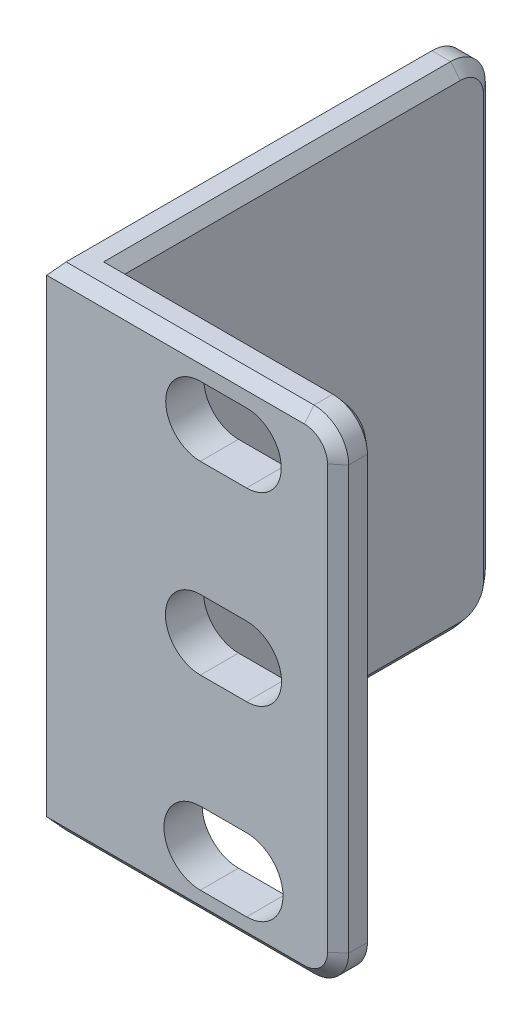
from build123d import *
from OCP.BRepFilletAPI import BRepFilletAPI_MakeChamfer

# Parameters (mm, degrees)
EXTRUDE_1_DEPTH     = 21.3
CUT_EXTRUDE_1_DEPTH = 42.6
FILLET_1_R          = 3
CHAMFER_1_SIZE      = 1
CHAMFER_1_SIZE2     = 0.839099631


with BuildPart() as part:
    # Эскиз1 → Бобышка-Вытянуть1 (new, symmetric)
    with BuildSketch(Plane(origin=(0, 0, 0), x_dir=(1, 0, 0), z_dir=(0, 1, 0))):
        Polygon((0, 0), (25.3, 0), (25.3, 3.3), (3.3, 3.3), (3.3, 35.5), (0, 35.5), align=None)
    extrude(amount=EXTRUDE_1_DEPTH, both=True)

    # Эскиз2 → Вырез-Вытянуть1 (cut)
    with BuildSketch(Plane.XY):
        with BuildLine():
            Line((17.3, 13), (13.3, 13))
            ThreePointArc((13.3, 13), (10.3, 16), (13.3, 19))
            Line((13.3, 19), (17.3, 19))
            ThreePointArc((17.3, 19), (20.3, 16), (17.3, 13))
        make_face()
        with BuildLine():
            Line((17.3, -3.022560491), (13.3, -3.022560491))
            ThreePointArc((13.3, -3.022560491), (10.277439509, 0), (13.3, 3.022560491))
            Line((13.3, 3.022560491), (17.3, 3.022560491))
            ThreePointArc((17.3, 3.022560491), (20.322560491, 0), (17.3, -3.022560491))
        make_face()
        with BuildLine():
            Line((17.3, -19.150761356), (13.3, -19.150761356))
            ThreePointArc((13.3, -19.150761356), (10.149238644, -16), (13.3, -12.849238644))
            Line((13.3, -12.849238644), (17.3, -12.849238644))
            ThreePointArc((17.3, -12.849238644), (20.450761356, -16), (17.3, -19.150761356))
        make_face()
    extrude(amount=-CUT_EXTRUDE_1_DEPTH, mode=Mode.SUBTRACT)

    # Скругление1
    fillet_1_edges = [part.edges().sort_by_distance(p)[0] for p in [
        (25.3, 21.3, -1.65),
        (1.65, 21.3, -35.5),
        (1.65, -21.3, -35.5),
        (25.3, -21.3, -1.65),
    ]]
    fillet(fillet_1_edges, radius=FILLET_1_R)

    # Фаска1: one chamfer whose edges measure the first distance from different faces: ONE call of the kernel's chamfer builder (chamfer() names one face for all edges)
    chamfer_1_edges_1 = [part.edges().sort_by_distance(p)[0] for p in [
        (24.421320344, -20.421320344, 0),
        (11.15, -21.3, 0),
        (11.15, 21.3, 0),
        (25.3, 0, 0),
        (24.421320344, 20.421320344, 0),
    ]]
    chamfer_1_side_1 = [part.faces().sort_by_distance(p)[0] for p in [
        (11.15, -20.804535571, 0),
    ]]
    chamfer_1_edges_2 = [part.edges().sort_by_distance(p)[0] for p in [
        (3.3, 21.3, -17.9),
        (3.3, -21.3, -17.9),
        (3.3, 0, -35.5),
        (3.3, 20.421320344, -34.621320344),
        (3.3, -20.421320344, -34.621320344),
    ]]
    chamfer_1_side_2 = [part.faces().sort_by_distance(p)[0] for p in [
        (3.3, 0, -19.356425923),
    ]]
    chamfer_1_edges_3 = [part.edges().sort_by_distance(p)[0] for p in [
        (0, 0, -35.5),
        (0, -21.3, -16.25),
        (0, 21.3, -16.25),
        (0, 20.421320344, -34.621320344),
        (0, -20.421320344, -34.621320344),
    ]]
    chamfer_1_side_3 = [part.faces().sort_by_distance(p)[0] for p in [
        (0, 0, -17.706261494),
    ]]
    chamfer_1_edges_4 = [part.edges().sort_by_distance(p)[0] for p in [
        (12.8, -21.3, -3.3),
        (12.8, 21.3, -3.3),
        (25.3, 0, -3.3),
        (24.421320344, 20.421320344, -3.3),
        (24.421320344, -20.421320344, -3.3),
    ]]
    chamfer_1_side_4 = [part.faces().sort_by_distance(p)[0] for p in [
        (24.820546144, 0, -3.3),
    ]]
    chamfer_1 = BRepFilletAPI_MakeChamfer(part.part.solid().wrapped)
    for e in chamfer_1_edges_1:
        chamfer_1.Add(CHAMFER_1_SIZE, CHAMFER_1_SIZE2, e.wrapped, chamfer_1_side_1[0].wrapped)  # the first distance lies on this face
    for e in chamfer_1_edges_2:
        chamfer_1.Add(CHAMFER_1_SIZE, CHAMFER_1_SIZE2, e.wrapped, chamfer_1_side_2[0].wrapped)  # the first distance lies on this face
    for e in chamfer_1_edges_3:
        chamfer_1.Add(CHAMFER_1_SIZE, CHAMFER_1_SIZE2, e.wrapped, chamfer_1_side_3[0].wrapped)  # the first distance lies on this face
    for e in chamfer_1_edges_4:
        chamfer_1.Add(CHAMFER_1_SIZE, CHAMFER_1_SIZE2, e.wrapped, chamfer_1_side_4[0].wrapped)  # the first distance lies on this face
    add(Compound.cast(chamfer_1.Shape()), mode=Mode.REPLACE)


solid = part.part
